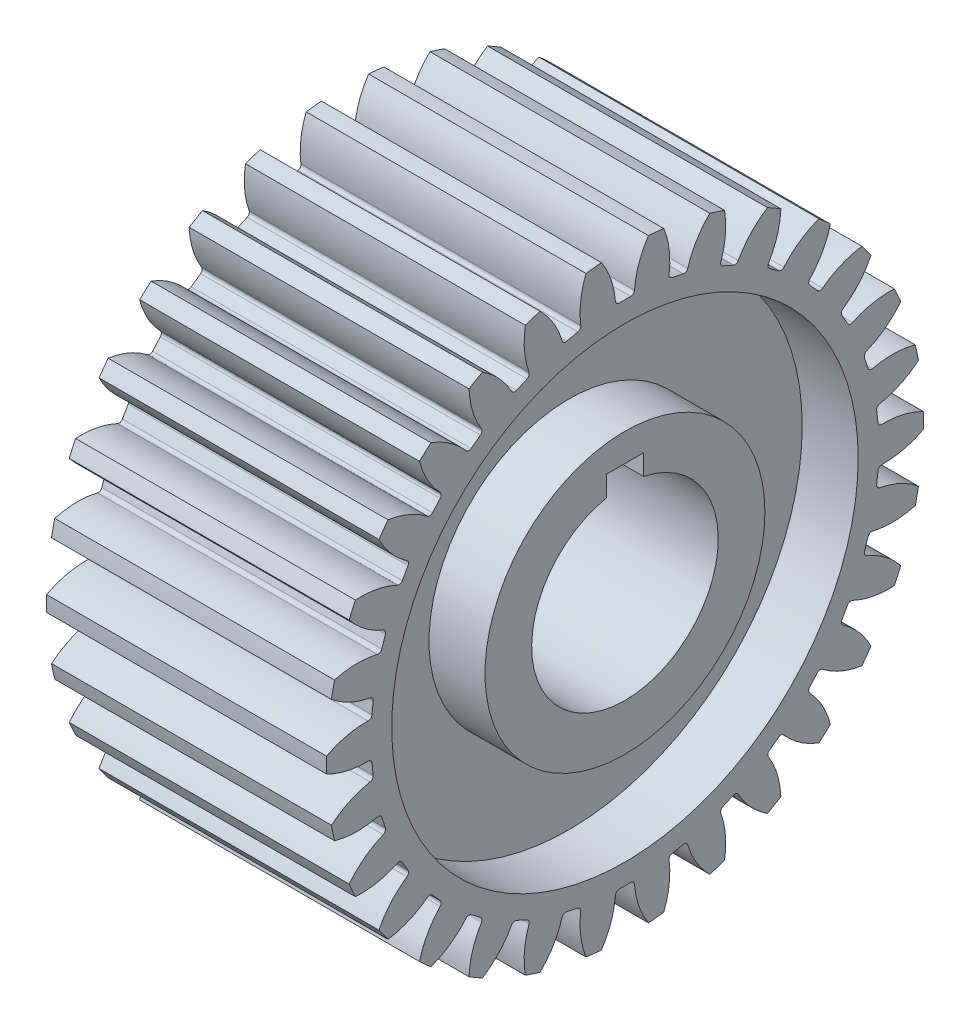
from build123d import *

# Parameters (mm, degrees)
SKETCH1_R                        = 16
CIRCULAR_EXTRUDE_DEPTH           = 7.5
CUT_CIRCULAR_TOP_RECTANGLE_DEPTH = 28.147743921
SKETCH4_R                        = 12.5
SKETCH4_R_2                      = 7.5
EXTRUDE_CUT_RAD_25_15_DEPTH      = 3
CUT_TOOTH_DEPTH                  = 28.147743921
F_30_NOS_COUNT                   = 30


with BuildPart() as part:
    # Sketch1 → circular - extrude (new, symmetric)
    with BuildSketch(Plane(origin=(0, 0, 0), x_dir=(0, 0, -1), z_dir=(1, 0, 0))):
        Circle(SKETCH1_R)
    extrude(amount=CIRCULAR_EXTRUDE_DEPTH, both=True)

    # Sketch3 → Cut- circular + top rectangle (cut, through all)
    with BuildSketch(Plane(origin=(7.5, 0, 0), x_dir=(0, 0, -1), z_dir=(1, 0, 0))):
        with BuildLine():
            Line((-1, 4.898979486), (-1, 6))
            Line((-1, 6), (1, 6))
            Line((1, 6), (1, 4.898979486))
            ThreePointArc((1, 4.898979486), (0, -5), (-1, 4.898979486))
        make_face()
    extrude(amount=-CUT_CIRCULAR_TOP_RECTANGLE_DEPTH, mode=Mode.SUBTRACT)

    # Sketch4 → extrude cut ( rad: 25 -15) (cut)
    with BuildSketch(Plane(origin=(7.5, 0, 0), x_dir=(0, 0, -1), z_dir=(1, 0, 0))):
        Circle(SKETCH4_R)
        Circle(SKETCH4_R_2, mode=Mode.SUBTRACT)
    extrude_cut_rad_25_15 = extrude(amount=-EXTRUDE_CUT_RAD_25_15_DEPTH, mode=Mode.SUBTRACT)

    # mirror - extrude cut: extrude cut ( rad: 25 -15) across plane
    add(extrude_cut_rad_25_15.mirror(Plane(origin=(0, 0, 0), x_dir=(0, 0, 1), z_dir=(1, 0, 0))), mode=Mode.SUBTRACT)

    # Sketch5 → Cut - tooth (cut, through all)
    with BuildSketch(Plane(origin=(7.5, 0, 0), x_dir=(0, 0, -1), z_dir=(1, 0, 0))):
        with BuildLine():
            ThreePointArc((-0.510792361, 13.784267691), (-0.447157321, 13.653121714), (-0.311412085, 13.6))
            Line((-0.311412085, 13.6), (0.311412085, 13.6))
            ThreePointArc((0.311412085, 13.6), (0.447157321, 13.653121714), (0.510792361, 13.784267691))
            ThreePointArc((0.510792361, 13.784267691), (0.746805037, 14.91511034), (1.259418951, 15.950356231))
            ThreePointArc((1.259418951, 15.950356231), (0, 16), (-1.259418951, 15.950356231))
            ThreePointArc((-1.259418951, 15.950356231), (-0.746805037, 14.91511034), (-0.510792361, 13.784267691))
        make_face()
    cut_tooth = extrude(amount=-CUT_TOOTH_DEPTH, mode=Mode.SUBTRACT)

    # 30 nos: Cut - tooth ×30 about axis
    f_30_nos_axis = Axis((0, 0, 0), (1, 0, 0))
    for i in range(1, F_30_NOS_COUNT):
        add(cut_tooth.rotate(f_30_nos_axis, i * 360 / F_30_NOS_COUNT), mode=Mode.SUBTRACT)


solid = part.part
